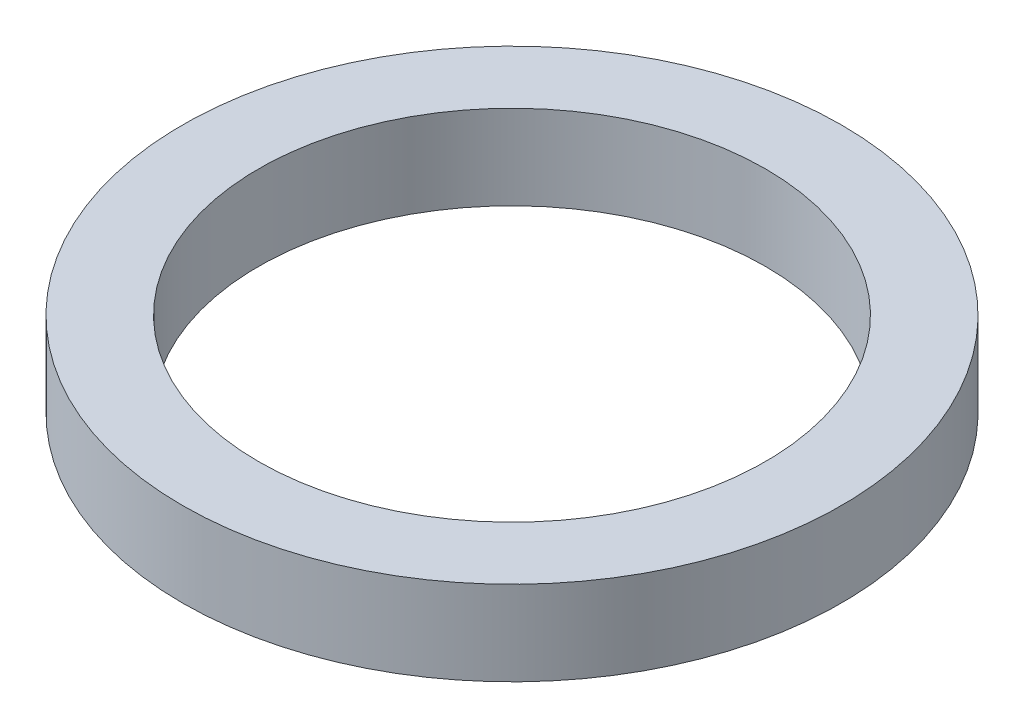
from build123d import *

# Parameters (mm, degrees)
SKETCH1_R           = 39
SKETCH1_R_2         = 30
BOSS_EXTRUDE1_DEPTH = 5


with BuildPart() as part:
    # Sketch1 → Boss-Extrude1 (new, symmetric)
    with BuildSketch(Plane(origin=(0, 0, 0), x_dir=(1, 0, 0), z_dir=(0, 1, 0))):
        with Locations(Location((0, 0, 0), (0, 0, 270))):
            Circle(SKETCH1_R)
        with Locations(Location((0, 0, 0), (0, 0, 270))):
            Circle(SKETCH1_R_2, mode=Mode.SUBTRACT)
    extrude(amount=BOSS_EXTRUDE1_DEPTH, both=True)


solid = part.part
